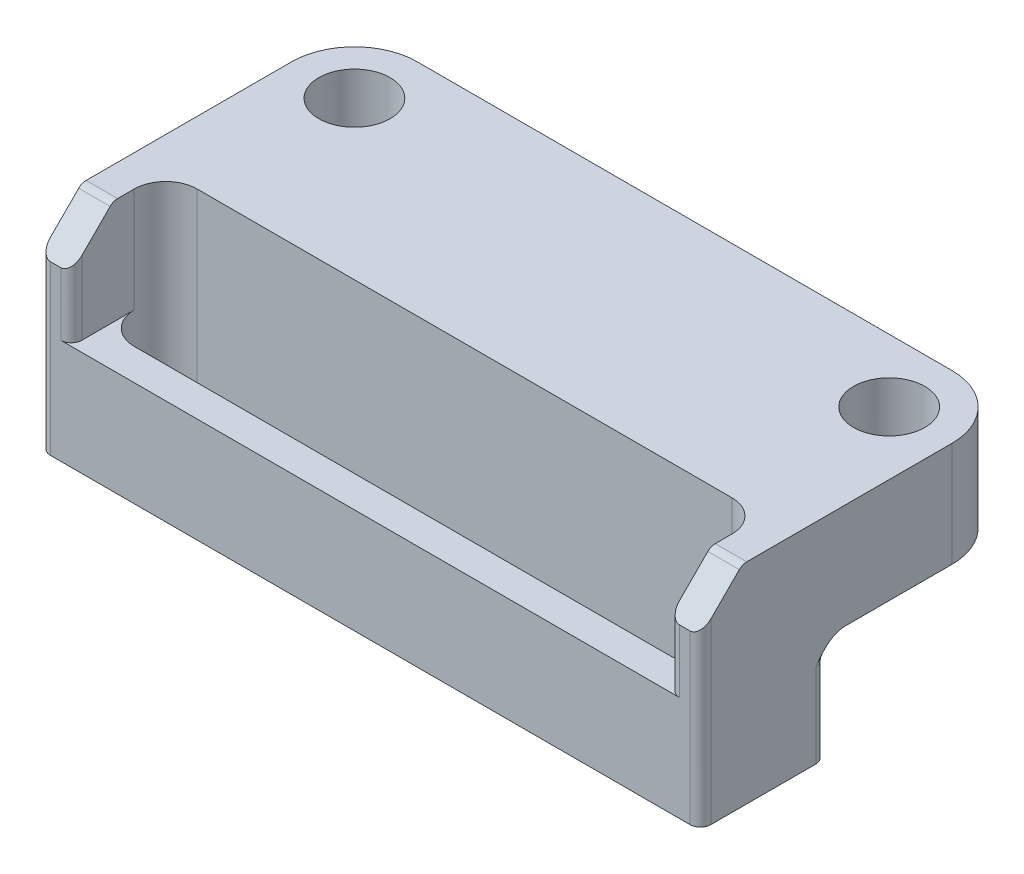
from build123d import *

# Parameters (mm, degrees)
BOSS_EXTRUDE1_DEPTH  = 5
M3_CLEARANCE_HOLE1_D = 3.4
CUT_EXTRUDE1_DEPTH   = 23.182481827
SKETCH5_W            = 9
SKETCH5_H            = 5
CUT_EXTRUDE2_DEPTH   = 35.077118423
CUT_EXTRUDE5_DEPTH   = 21.422108118
CHAMFER1_SIZE        = 2
FILLET5_R            = 0.5
FILLET6_R            = 1


with BuildPart() as part:
    # Sketch1 → Boss-Extrude1 (new, symmetric)
    with BuildSketch(Plane(origin=(0, 0, 0), x_dir=(1, 0, 0), z_dir=(0, 1, 0))):
        with BuildLine():
            Line((12.75, 3), (-12.75, 3))
            ThreePointArc((-12.75, 3), (-14.871320344, 2.121320344), (-15.75, 0))
            Line((-15.75, 0), (-15.75, -12))
            Line((-15.75, -12), (15.75, -12))
            Line((15.75, -12), (15.75, 0))
            ThreePointArc((15.75, 0), (14.871320344, 2.121320344), (12.75, 3))
        make_face()
    extrude(amount=BOSS_EXTRUDE1_DEPTH, both=True)

    # M3 Clearance Hole1 (through all)
    with Locations(Plane(origin=(0, 5, 0), x_dir=(1, 0, 0), z_dir=(0, 1, 0))):
        with Locations((-12.75, 0), (12.75, 0)):
            Hole(M3_CLEARANCE_HOLE1_D / 2)

    # Sketch4 → Cut-Extrude1 (cut, through all)
    with BuildSketch(Plane(origin=(0, 5, 0), x_dir=(1, 0, 0), z_dir=(0, 1, 0))):
        with BuildLine():
            Line((-12.75, -7.5), (12.75, -7.5))
            ThreePointArc((12.75, -7.5), (14.25, -9), (12.75, -10.5))
            Line((12.75, -10.5), (-12.75, -10.5))
            ThreePointArc((-12.75, -10.5), (-14.25, -9), (-12.75, -7.5))
        make_face()
    extrude(amount=-CUT_EXTRUDE1_DEPTH, mode=Mode.SUBTRACT)

    # Sketch5 → Cut-Extrude2 (cut, through all)
    with BuildSketch(Plane(origin=(15.75, 0, 0), x_dir=(0, 0, -1), z_dir=(1, 0, 0))):
        with Locations((-1.5, -2.5)):
            Rectangle(SKETCH5_W, SKETCH5_H)
    extrude(amount=-CUT_EXTRUDE2_DEPTH, mode=Mode.SUBTRACT)

    # Sketch6 → Cut-Extrude5 (cut, through all)
    with BuildSketch(Plane.XY.offset(9)):
        Polygon((-12.75, 5), (-14.25, 5), (-14.25, 0), (14.25, 0), (14.25, 5), (12.75, 5), align=None)
    extrude(amount=CUT_EXTRUDE5_DEPTH, mode=Mode.SUBTRACT)

    # Chamfer1
    chamfer1_edges = [part.edges().sort_by_distance(p)[0] for p in [
        (-15, 5, 12),
        (15, 5, 12),
    ]]
    chamfer(chamfer1_edges, length=CHAMFER1_SIZE)

    # Fillet5
    fillet5_edges = [part.edges().sort_by_distance(p)[0] for p in [
        (-15, 5, 10),
        (15, 5, 10),
        (15.75, -1, 12),
        (-14.25, 1.5, 12),
        (-15.75, -1, 12),
        (15.75, -2.5, 6),
        (-15.75, -2.5, 6),
        (14.25, 1.5, 12),
    ]]
    fillet(fillet5_edges, radius=FILLET5_R)

    # Fillet6
    fillet6_edges = [part.edges().sort_by_distance(p)[0] for p in [
        (0, 0, 6),
        (-15.603553391, 0, 6.146446609),
        (15.603553391, 0, 6.146446609),
    ]]
    fillet(fillet6_edges, radius=FILLET6_R)


solid = part.part
